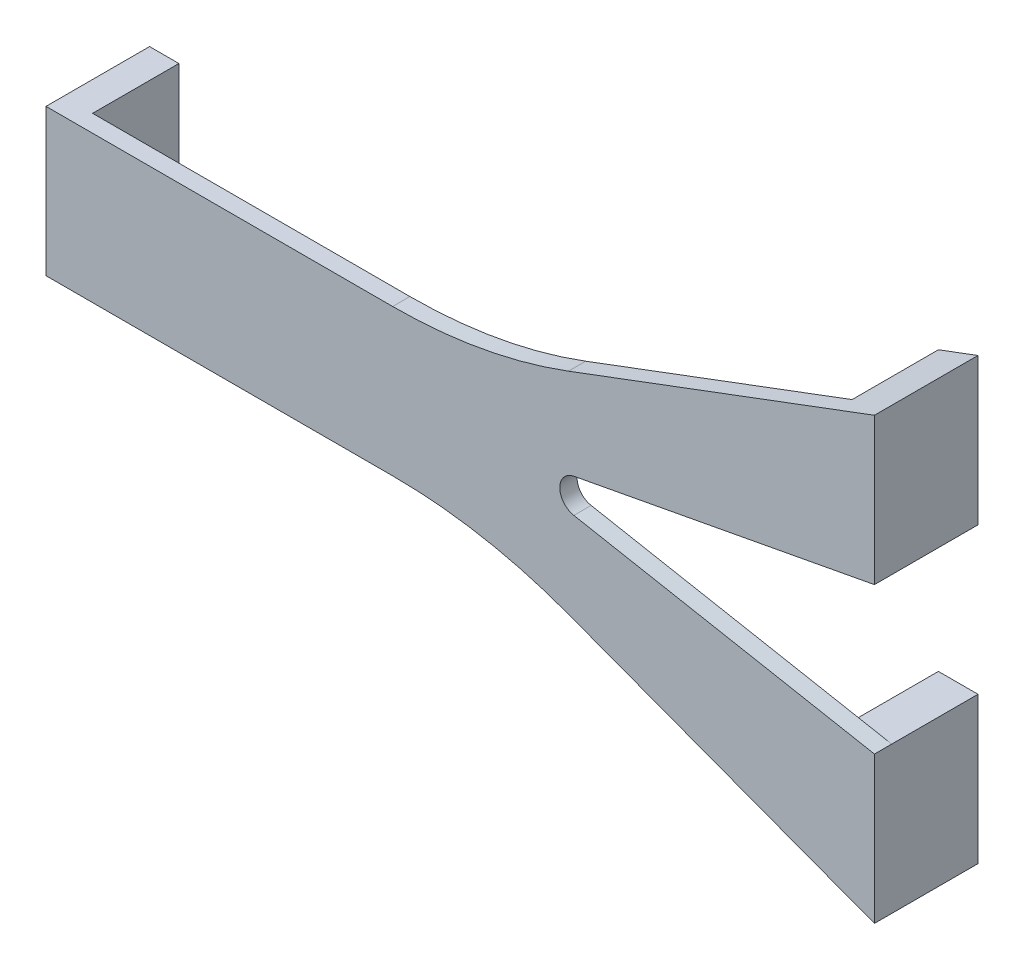
from build123d import *

# Parameters (mm, degrees)
EXTRUDE_1_DEPTH = 2
SKETCH_3_W      = 3.4
SKETCH_3_H      = 17
EXTRUDE_2_DEPTH = 10


with BuildPart() as part:
    # 스케치1 → 보스-돌출1 (new body)
    with BuildSketch(Plane.XY):
        with BuildLine():
            Line((-0.518908087, 12.196403379), (34.938840058, 25.5))
            Line((34.938840058, 25.5), (34.938840058, 8.5))
            Line((34.938840058, 8.5), (0.107473336, 1.965709515))
            ThreePointArc((0.107473336, 1.965709515), (-1.52376373, 0), (0.107473336, -1.965709515))
            Line((0.107473336, -1.965709515), (34.938840058, -8.5))
            Line((34.938840058, -8.5), (34.938840058, -25.5))
            Line((34.938840058, -25.5), (-0.518908087, -12.196403379))
            ThreePointArc((-0.518908087, -12.196403379), (-10.539851544, -9.431582272), (-20.893387075, -8.5))
            Line((-20.893387075, -8.5), (-61.061159942, -8.5))
            Line((-61.061159942, -8.5), (-61.061159942, 8.5))
            Line((-61.061159942, 8.5), (-20.893387075, 8.5))
            ThreePointArc((-20.893387075, 8.5), (-10.539851544, 9.431582272), (-0.518908087, 12.196403379))
        make_face()
    extrude(amount=EXTRUDE_1_DEPTH)

    # 스케치3 → 보스-돌출2 (add)
    with BuildSketch(Plane(origin=(0, 0, 0), x_dir=(-1, 0, 0), z_dir=(0, 0, -1))):
        Polygon((-34.938840058, 25.5), (-34.938840058, 8.5), (-30.348840058, 8.5), (-30.348840058, 23.77785148), align=None)
        Polygon((-34.938840058, -8.5), (-34.938840058, -25.5), (-30.348840058, -23.77785148), (-30.348840058, -8.5), align=None)
        with Locations((59.361159942, 0)):
            Rectangle(SKETCH_3_W, SKETCH_3_H)
    extrude(amount=EXTRUDE_2_DEPTH)


solid = part.part
